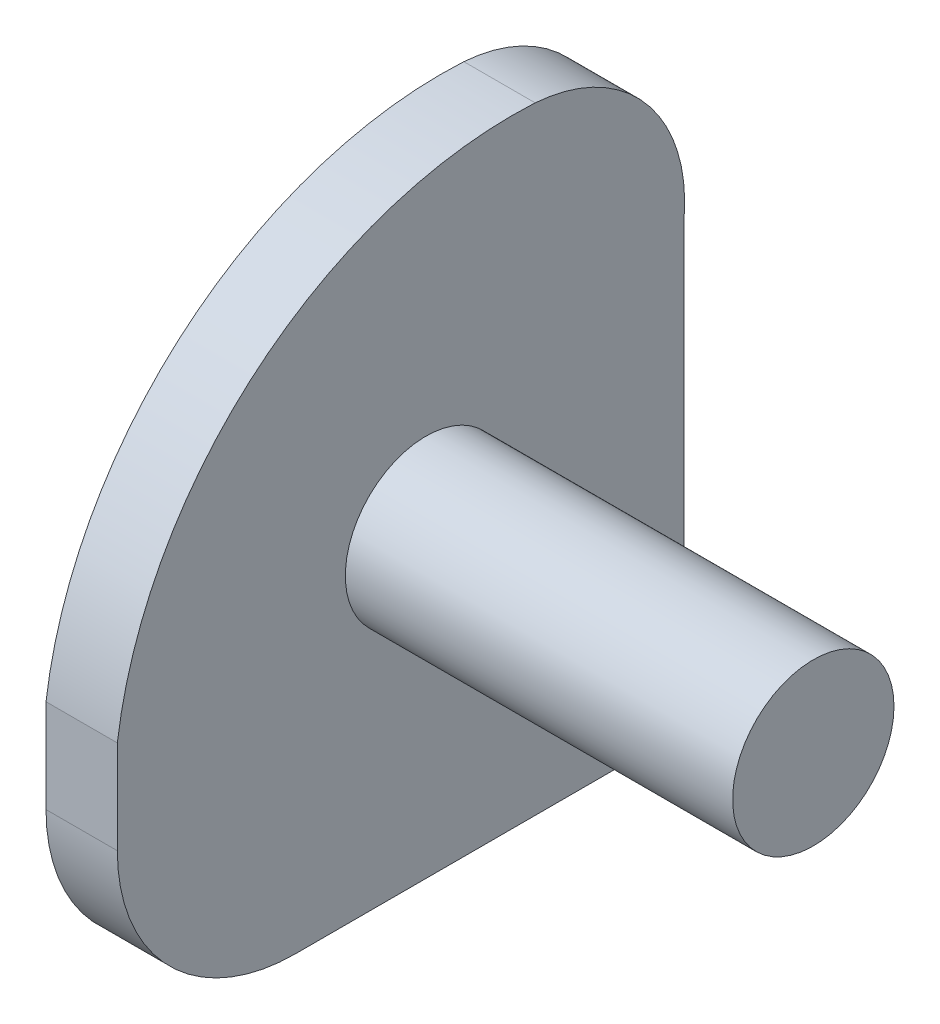
from build123d import *

# Parameters (mm, degrees)
BOSS_EXTRUDE1_DEPTH = 20
SCALE1_SCALE        = 0.110510806
SKETCH4_R           = 2.5
BOSS_EXTRUDE2_DEPTH = 12


with BuildPart() as part:
    # Sketch3 → Boss-Extrude1 (new body)
    with BuildSketch(Plane(origin=(0, 0, 0), x_dir=(0, 0, -1), z_dir=(1, 0, 0))):
        with BuildLine():
            Line((0, -60), (0, -86.184781703))
            ThreePointArc((0, -86.184781703), (14.644660941, -121.540120762), (50, -136.184781703))
            Line((50, -136.184781703), (59.297038535, -136.184781703))
            Line((59.297038535, -136.184781703), (138.939006392, -136.184781703))
            ThreePointArc((138.939006392, -136.184781703), (153.081142016, -130.326917326), (158.939006392, -116.184781703))
            Line((158.939006392, -116.184781703), (158.939006392, -50))
            Line((158.939006392, -50), (158.939006392, -11.480346054))
            ThreePointArc((158.939006392, -11.480346054), (148.053108697, 21.328755123), (117.156078712, 36.830801017))
            ThreePointArc((117.156078712, 36.830801017), (39.60735059, 11.368133348), (0, -60))
        make_face()
    extrude(amount=BOSS_EXTRUDE1_DEPTH)


with BuildPart() as part_1:
    # Scale1: scaled about (10, -55.771836123, -85.371281571)
    add(part.part.scale(SCALE1_SCALE).moved(Location((8.89489194, -49.608445561, -75.936832435))))

    # Sketch4 → Boss-Extrude2 (add)
    with BuildSketch(Plane(origin=(11.10510806, 0, 0), x_dir=(0, 0, -1), z_dir=(1, 0, 0))):
        with Locations((85.501310137, -55.288244055)):
            Circle(SKETCH4_R)
    extrude(amount=BOSS_EXTRUDE2_DEPTH)


solid = part_1.part
